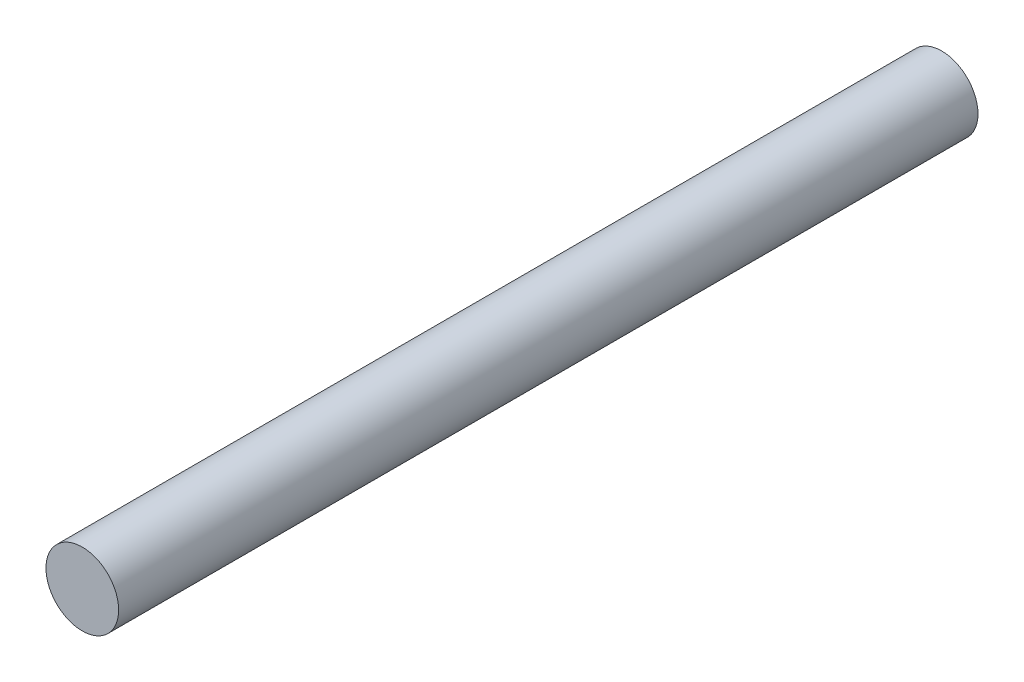
from build123d import *

# Parameters (mm, degrees)
SKETCH1_R        = 11
HANDLEPOST_DEPTH = 260


with BuildPart() as part:
    # Sketch1 → HandlePost (new body)
    with BuildSketch(Plane.XY):
        Circle(SKETCH1_R)
    extrude(amount=HANDLEPOST_DEPTH)


solid = part.part
